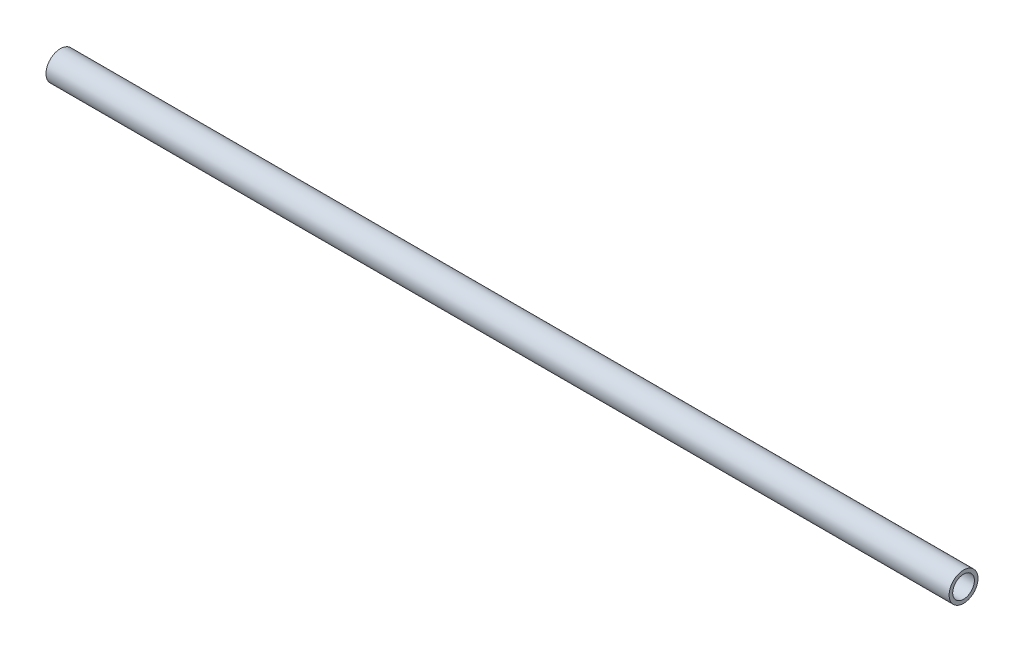
from build123d import *

# Parameters (mm, degrees)
SKETCH1_R           = 4
SKETCH1_R_2         = 3
BOSS_EXTRUDE1_DEPTH = 250


with BuildPart() as part:
    # Sketch1 → Boss-Extrude1 (new body)
    with BuildSketch(Plane(origin=(0, 0, 0), x_dir=(0, 0, -1), z_dir=(1, 0, 0))):
        Circle(SKETCH1_R)
        Circle(SKETCH1_R_2, mode=Mode.SUBTRACT)
    extrude(amount=BOSS_EXTRUDE1_DEPTH)


solid = part.part
